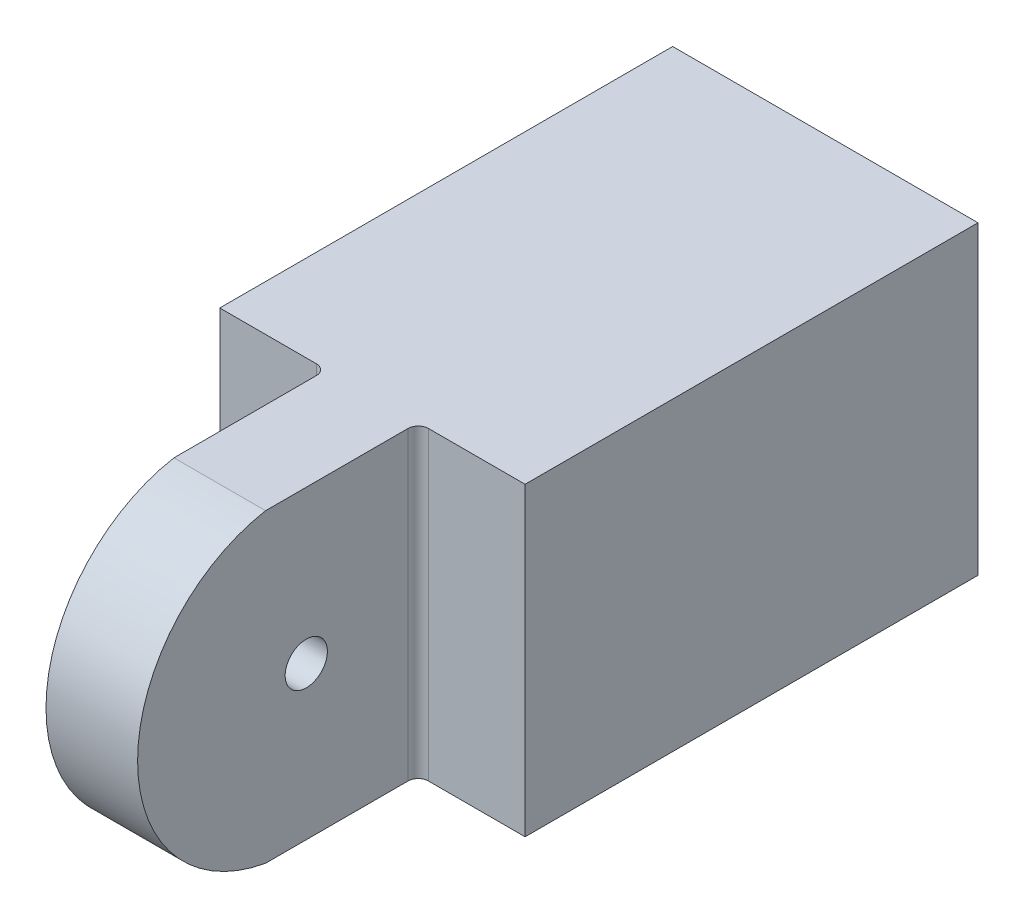
from build123d import *

# Parameters (mm, degrees)
SKETCH2_W           = 60
SKETCH2_H           = 60
BOSS_EXTRUDE1_DEPTH = 89
SKETCH3_W           = 18
SKETCH3_H           = 60
BOSS_EXTRUDE2_DEPTH = 30
BOSS_EXTRUDE3_DEPTH = 18
FILLET1_R           = 2
SKETCH7_W           = 50
SKETCH7_H           = 50
CUT_EXTRUDE1_DEPTH  = 81
SKETCH8_R           = 4.15
CUT_EXTRUDE2_DEPTH  = 153.311146429


with BuildPart() as part:
    # Sketch2 → Boss-Extrude1 (new body)
    with BuildSketch(Plane.XY):
        Rectangle(SKETCH2_W, SKETCH2_H)
    extrude(amount=BOSS_EXTRUDE1_DEPTH)

    # Sketch3 → Boss-Extrude2 (add)
    with BuildSketch(Plane.XY.offset(89)):
        Rectangle(SKETCH3_W, SKETCH3_H)
    extrude(amount=BOSS_EXTRUDE2_DEPTH)

    # Sketch4 → Boss-Extrude3 (add)
    with BuildSketch(Plane(origin=(9, 0, 0), x_dir=(0, 0, -1), z_dir=(1, 0, 0))):
        with BuildLine():
            Line((-119, -30), (-119, 30))
            ThreePointArc((-119, 30), (-144.144668047, 0), (-119, -30))
        make_face()
    extrude(amount=-BOSS_EXTRUDE3_DEPTH)

    # Fillet1
    fillet1_edges = [part.edges().sort_by_distance(p)[0] for p in [
        (-9, 0, 89),
        (9, 0, 89),
    ]]
    fillet(fillet1_edges, radius=FILLET1_R)

    # Sketch7 → Cut-Extrude1 (cut)
    with BuildSketch(Plane(origin=(0, 0, 0), x_dir=(-1, 0, 0), z_dir=(0, 0, -1))):
        Rectangle(SKETCH7_W, SKETCH7_H)
    extrude(amount=-CUT_EXTRUDE1_DEPTH, mode=Mode.SUBTRACT)

    # Sketch8 → Cut-Extrude2 (cut, through all)
    with BuildSketch(Plane.ZY.offset(9)):
        with Locations((111, 0)):
            Circle(SKETCH8_R)
    extrude(amount=-CUT_EXTRUDE2_DEPTH, mode=Mode.SUBTRACT)


solid = part.part
